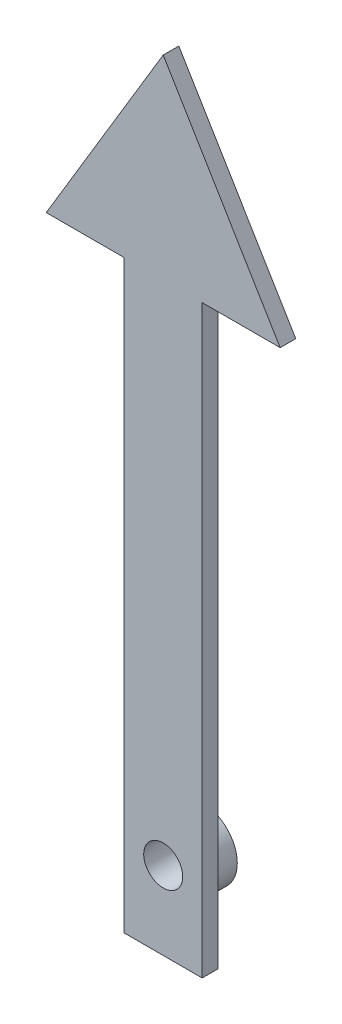
from build123d import *

# Parameters (mm, degrees)
BOSS_EXTRUDE1_DEPTH = 0.508
SKETCH3_R           = 0.635
CUT_EXTRUDE1_DEPTH  = 26.689183794
SKETCH5_R           = 1.143
SKETCH5_R_2         = 0.635
BOSS_EXTRUDE2_DEPTH = 0.762


with BuildPart() as part:
    # Sketch1 → Boss-Extrude1 (new body)
    with BuildSketch(Plane.XY):
        Polygon((1.27, 0), (1.27, 19.05), (3.81, 19.05), (0, 25.4), (-3.81, 19.05), (-1.27, 19.05), (-1.27, 0), align=None)
    extrude(amount=BOSS_EXTRUDE1_DEPTH)

    # Sketch3 → Cut-Extrude1 (cut, through all)
    with BuildSketch(Plane.XY.offset(0.508)):
        with Locations((0, 2.54)):
            Circle(SKETCH3_R)
    extrude(amount=-CUT_EXTRUDE1_DEPTH, mode=Mode.SUBTRACT)

    # Sketch5 → Boss-Extrude2 (add)
    with BuildSketch(Plane(origin=(0, 0, 0), x_dir=(-1, 0, 0), z_dir=(0, 0, -1))):
        with Locations(Location((0, 2.54, 0), (0, 0, 180))):
            Circle(SKETCH5_R)
        with Locations(Location((0, 2.54, 0), (0, 0, 180))):
            Circle(SKETCH5_R_2, mode=Mode.SUBTRACT)
    extrude(amount=BOSS_EXTRUDE2_DEPTH)


solid = part.part
